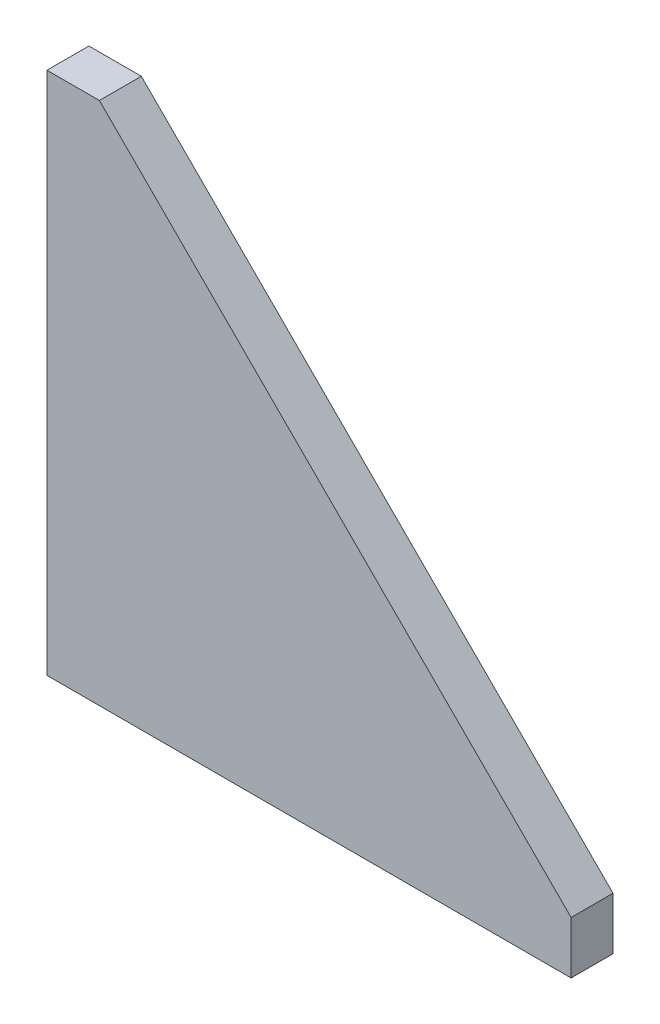
from build123d import *

# Parameters (mm, degrees)
BOSS_EXTRUDE1_DEPTH = 12
SKETCH2_R           = 2.5
CUT_EXTRUDE2_DEPTH  = 15
SKETCH3_R           = 2.5
CUT_EXTRUDE4_DEPTH  = 15


with BuildPart() as part:
    # Sketch1 → Boss-Extrude1 (new body)
    with BuildSketch(Plane.XY):
        Polygon((0, 0), (150, 0), (150, 15), (15, 150), (0, 150), align=None)
    extrude(amount=BOSS_EXTRUDE1_DEPTH)

    # Sketch2 → Cut-Extrude2 (cut)
    with BuildSketch(Plane(origin=(0, 0, 0), x_dir=(1, 0, 0), z_dir=(0, 1, 0))):
        with Locations(Location((33, -6, 0), (0, 0, 270))):
            Circle(SKETCH2_R)
        with Locations(Location((113, -6, 0), (0, 0, 270))):
            Circle(SKETCH2_R)
    extrude(amount=CUT_EXTRUDE2_DEPTH, mode=Mode.SUBTRACT)

    # Sketch3 → Cut-Extrude4 (cut)
    with BuildSketch(Plane(origin=(0, 0, 0), x_dir=(0, 0, -1), z_dir=(1, 0, 0))):
        with Locations((-6, 50)):
            Circle(SKETCH3_R)
        with Locations((-6, 120)):
            Circle(SKETCH3_R)
    extrude(amount=CUT_EXTRUDE4_DEPTH, mode=Mode.SUBTRACT)


solid = part.part
